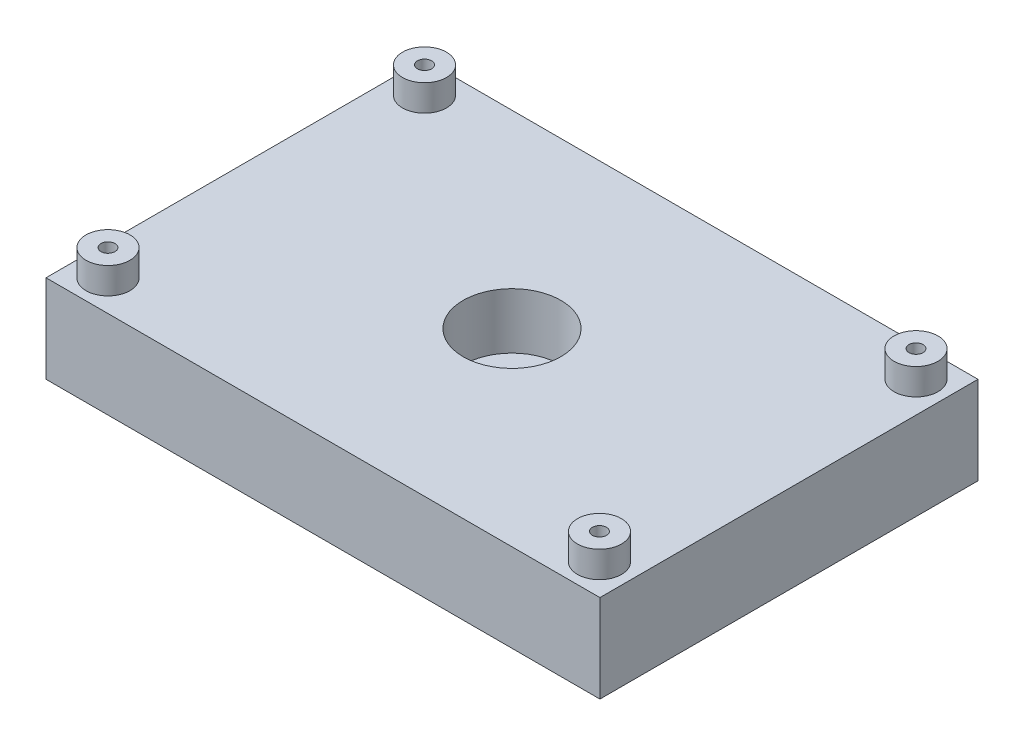
from build123d import *

# Parameters (mm, degrees)
SKETCH1_W                                        = 63
SKETCH1_H                                        = 43
BOSS_EXTRUDE1_DEPTH                              = 10
CBORE_FOR_1_4_SOCKET_HEAD_CAP_SCREW1_D           = 6.7564
CBORE_FOR_1_4_SOCKET_HEAD_CAP_SCREW1_CBORE_D     = 11.1125
CBORE_FOR_1_4_SOCKET_HEAD_CAP_SCREW1_CBORE_DEPTH = 6.35
SKETCH6_R                                        = 2.5
BOSS_EXTRUDE2_DEPTH                              = 3
M2X0_4_TAPPED_HOLE1_D                            = 1.6


with BuildPart() as part:
    # Sketch1 → Boss-Extrude1 (new body)
    with BuildSketch(Plane(origin=(0, 0, 0), x_dir=(1, 0, 0), z_dir=(0, 1, 0))):
        Rectangle(SKETCH1_W, SKETCH1_H)
    extrude(amount=BOSS_EXTRUDE1_DEPTH)

    # CBORE for 1/4 Socket Head Cap Screw1 (through all)
    with Locations(Plane(origin=(0, 10, 0), x_dir=(1, 0, 0), z_dir=(0, 1, 0))):
        with Locations((0, 0)):
            CounterBoreHole(CBORE_FOR_1_4_SOCKET_HEAD_CAP_SCREW1_D / 2, CBORE_FOR_1_4_SOCKET_HEAD_CAP_SCREW1_CBORE_D / 2, CBORE_FOR_1_4_SOCKET_HEAD_CAP_SCREW1_CBORE_DEPTH)

    # Sketch6 → Boss-Extrude2 (add)
    with BuildSketch(Plane(origin=(0, 10, 0), x_dir=(1, 0, 0), z_dir=(0, 1, 0))):
        with Locations(Location((-27.95, 18, 0), (0, 0, 90))):
            Circle(SKETCH6_R)
        with Locations(Location((27.95, 18, 0), (0, 0, 90))):
            Circle(SKETCH6_R)
        with Locations(Location((27.95, -18, 0), (0, 0, 90))):
            Circle(SKETCH6_R)
        with Locations(Location((-27.95, -18, 0), (0, 0, 90))):
            Circle(SKETCH6_R)
    extrude(amount=BOSS_EXTRUDE2_DEPTH)

    # M2x0.4 Tapped Hole1 (through all)
    with Locations(Plane(origin=(0, 13, 0), x_dir=(1, 0, 0), z_dir=(0, 1, 0))):
        with Locations((-27.95, 18), (27.95, 18), (27.95, -18), (-27.95, -18)):
            Hole(M2X0_4_TAPPED_HOLE1_D / 2)


solid = part.part
